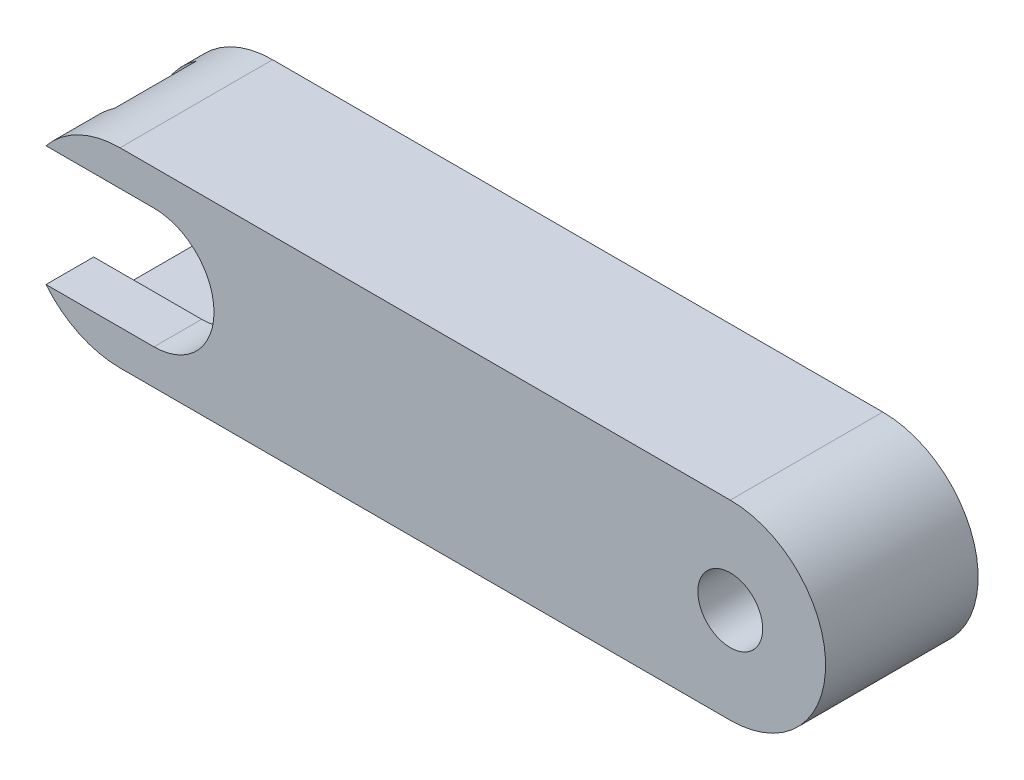
from build123d import *

# Parameters (mm, degrees)
SKETCH1_R           = 1.7
BOSS_EXTRUDE1_DEPTH = 8
CUT_EXTRUDE1_DEPTH  = 2.5
CUT_EXTRUDE2_DEPTH  = 4.3


with BuildPart() as part:
    # Sketch1 → Boss-Extrude1 (new body)
    with BuildSketch(Plane.XY):
        with BuildLine():
            Line((-16, 5), (16, 5))
            ThreePointArc((16, 5), (21, 0), (16, -5))
            Line((16, -5), (-16, -5))
            ThreePointArc((-16, -5), (-21, 0), (-16, 5))
        make_face()
        with Locations((-14.2222, 0)):
            Circle(SKETCH1_R, mode=Mode.SUBTRACT)
        with Locations((16, 0)):
            Circle(SKETCH1_R, mode=Mode.SUBTRACT)
    extrude(amount=BOSS_EXTRUDE1_DEPTH)

    # Sketch3 → Cut-Extrude1 (cut)
    with BuildSketch(Plane.XY.offset(8)):
        with BuildLine():
            Line((-20.2222, 3.15), (-14.2222, 3.15))
            ThreePointArc((-14.2222, 3.15), (-11.0722, 0), (-14.2222, -3.15))
            Line((-14.2222, -3.15), (-20.2222, -3.15))
            ThreePointArc((-20.2222, -3.15), (-23.3722, 0), (-20.2222, 3.15))
        make_face()
    extrude(amount=-CUT_EXTRUDE1_DEPTH, mode=Mode.SUBTRACT)

    # Sketch4 → Cut-Extrude2 (cut)
    with BuildSketch(Plane.XY.offset(5.5)):
        with BuildLine():
            Line((-21, 4.15), (-14.2222, 4.15))
            ThreePointArc((-14.2222, 4.15), (-10.0722, 0), (-14.2222, -4.15))
            Line((-14.2222, -4.15), (-21, -4.15))
            ThreePointArc((-21, -4.15), (-25.15, 0), (-21, 4.15))
        make_face()
    extrude(amount=-CUT_EXTRUDE2_DEPTH, mode=Mode.SUBTRACT)


solid = part.part
